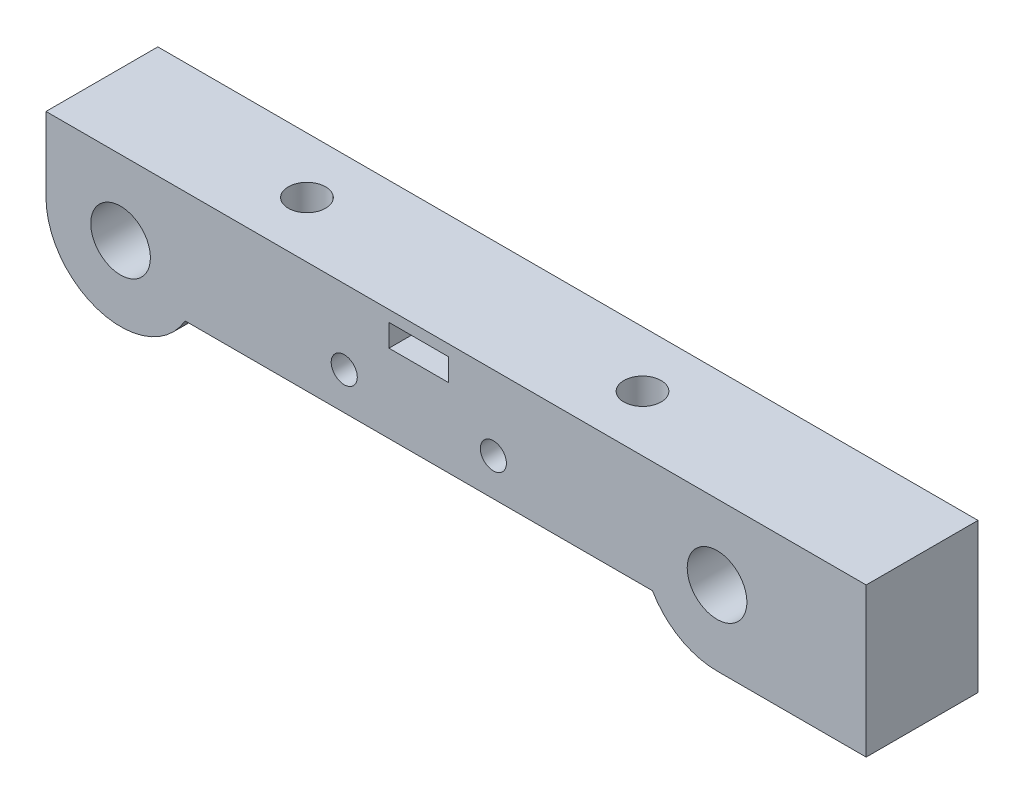
from build123d import *

# Parameters (mm, degrees)
ESBO_O1_R                = 4
ESBO_O1_R_2              = 1.75
ESBO_O1_W                = 8
ESBO_O1_H                = 3
RESSALTO_EXTRUS_O1_DEPTH = 15
ESBO_O2_R                = 2.5
CORTE_EXTRUS_O1_DEPTH    = 15


with BuildPart() as part:
    # Esboço1 → Ressalto-extrusão1 (new body)
    with BuildSketch(Plane.XY):
        with BuildLine():
            Line((-50, -10), (-50, 0))
            Line((-50, 0), (50, 0))
            Line((50, 0), (60, 0))
            Line((60, 0), (60, -20))
            Line((60, -20), (40, -20))
            ThreePointArc((40, -20), (35, -18.660254038), (31.339745962, -15))
            Line((31.339745962, -15), (-31.339745962, -15))
            ThreePointArc((-31.339745962, -15), (-42.588190451, -19.659258263), (-50, -10))
        make_face()
        with Locations((-40, -10)):
            Circle(ESBO_O1_R, mode=Mode.SUBTRACT)
        with Locations(Location((40, -10, 0), (0, 0, 180))):
            Circle(ESBO_O1_R, mode=Mode.SUBTRACT)
        with Locations((10, -10)):
            Circle(ESBO_O1_R_2, mode=Mode.SUBTRACT)
        with Locations((-10, -10)):
            Circle(ESBO_O1_R_2, mode=Mode.SUBTRACT)
        with Locations((0, -3)):
            Rectangle(ESBO_O1_W, ESBO_O1_H, mode=Mode.SUBTRACT)
    extrude(amount=RESSALTO_EXTRUS_O1_DEPTH)

    # Esboço2 → Corte-extrusão1 (cut)
    with BuildSketch(Plane.XZ.offset(15)):
        with Locations((22.5, 7.5)):
            Circle(ESBO_O2_R)
        with Locations((-22.5, 7.5)):
            Circle(ESBO_O2_R)
    extrude(amount=-CORTE_EXTRUS_O1_DEPTH, mode=Mode.SUBTRACT)


solid = part.part
